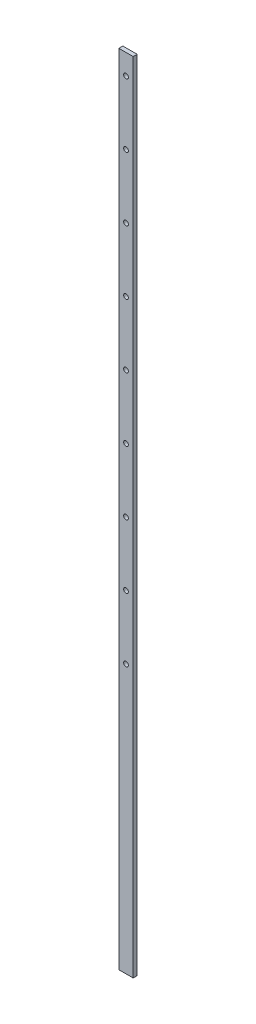
from build123d import *

# Parameters (mm, degrees)
SKETCH1_W           = 18
SKETCH1_H           = 1003
BOSS_EXTRUDE1_DEPTH = 5
SKETCH2_R           = 3
CUT_EXTRUDE1_DEPTH  = 5
LPATTERN1_COUNT     = 9
LPATTERN1_PITCH     = 80


with BuildPart() as part:
    # Sketch1 → Boss-Extrude1 (new body)
    with BuildSketch(Plane.XY):
        Rectangle(SKETCH1_W, SKETCH1_H)
    extrude(amount=BOSS_EXTRUDE1_DEPTH)

    # Sketch2 → Cut-Extrude1 (cut)
    with BuildSketch(Plane.XY.offset(5)):
        with Locations((0, 475.82)):
            Circle(SKETCH2_R)
    cut_extrude1 = extrude(amount=-CUT_EXTRUDE1_DEPTH, mode=Mode.SUBTRACT)

    # LPattern1: Cut-Extrude1 ×9
    with Locations(*[(0, -i * LPATTERN1_PITCH, 0) for i in range(1, LPATTERN1_COUNT)]):
        add(cut_extrude1, mode=Mode.SUBTRACT)


solid = part.part
